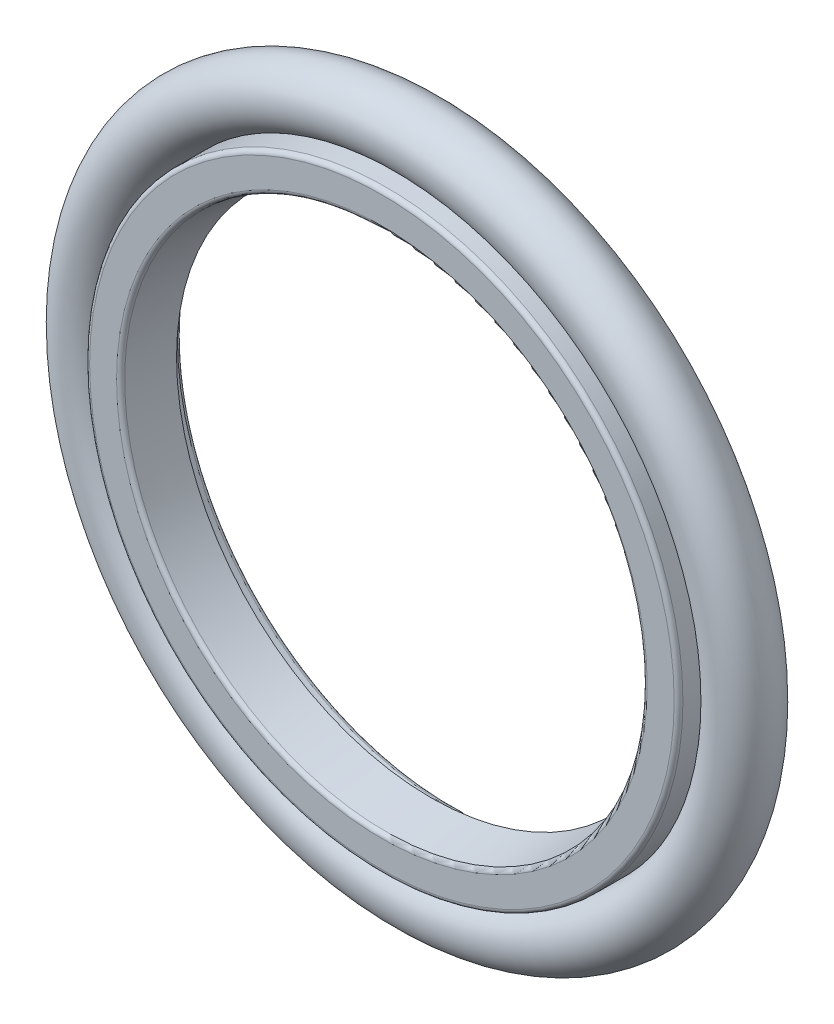
from build123d import *

# Parameters (mm, degrees)
SKETCH2_R = 1.75


with BuildPart() as part:
    # Sketch1 → Revolve1 (revolve)
    with BuildSketch(Plane(origin=(0, 0, 0), x_dir=(0, 0, -1), z_dir=(1, 0, 0)), mode=Mode.PRIVATE) as revolve1_sk:
        with BuildLine():
            Line((0.25, 16.9), (3.75, 16.9))
            ThreePointArc((3.75, 16.9), (3.926776695, 16.826776695), (4, 16.65))
            Line((4, 16.65), (4, 15.65))
            ThreePointArc((4, 15.65), (3.926776695, 15.473223305), (3.75, 15.4))
            Line((3.75, 15.4), (3.2, 15.4))
            Line((3.2, 15.4), (2.8, 14.5))
            Line((2.8, 14.5), (0.214644661, 14.869336477))
            ThreePointArc((0.214644661, 14.869336477), (0.061136511, 14.953023415), (0, 15.11682385))
            Line((0, 15.11682385), (0, 16.65))
            ThreePointArc((0, 16.65), (0.073223305, 16.826776695), (0.25, 16.9))
        make_face()
    revolve(revolve1_sk.sketch.rotate(Axis((0, 0, 0), (0, 0, -1)), 90), axis=Axis((0, 0, 0), (0, 0, -1)))


with BuildPart() as body_2:
    # Sketch2 → Revolve2 (revolve)
    with BuildSketch(Plane(origin=(0, 0, 0), x_dir=(0, 0, -1), z_dir=(1, 0, 0)), mode=Mode.PRIVATE) as revolve2_sk:
        with Locations((2, 18.65)):
            Circle(SKETCH2_R)
    revolve(revolve2_sk.sketch.rotate(Axis((0, 0, 0), (0, 0, -1)), 270), axis=Axis((0, 0, 0), (0, 0, -1)))


solid = Compound([part.part, body_2.part])
